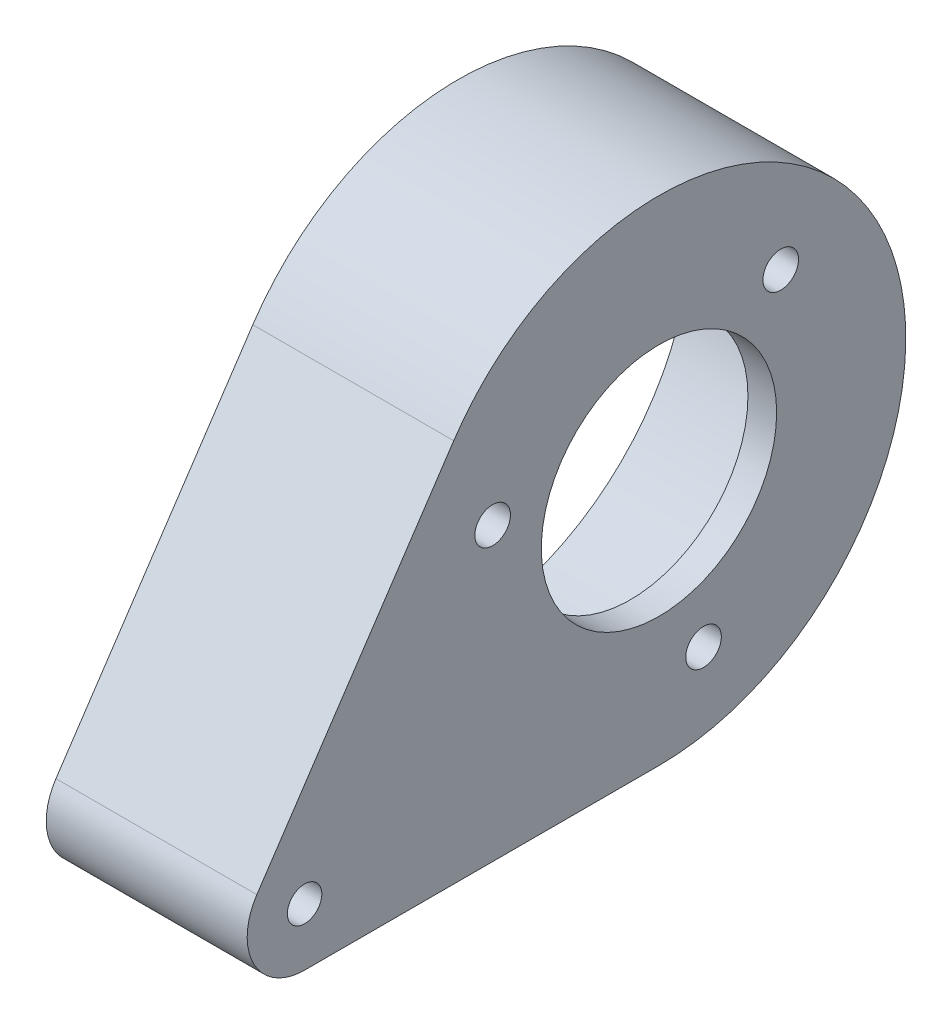
from build123d import *
from build123d.topology import SkipClean

# Parameters (mm, degrees)
EXTRUDE_1_DEPTH     = 2.5
EXTRUDE_START       = 15
SKETCH_2_R          = 20.25
EXTRUDE_2_DEPTH     = 15
SKETCH_3_R          = 1.55
SKETCH_3_R_2        = 10.25
CUT_EXTRUDE_1_DEPTH = 2.5
SKETCH_5_R          = 1.5
CUT_EXTRUDE_2_DEPTH = 46.33118669


with BuildPart() as part:
    # Эскиз1 → Бобышка-Вытянуть1 (new body)
    with BuildSketch(Plane(origin=(0, 0, 0), x_dir=(0, 0, -1), z_dir=(1, 0, 0))):
        with BuildLine():
            Line((-30.866648668, -21.5), (0, -21.5))
            ThreePointArc((0, -21.5), (18.960941325, 10.135714286), (-17.877458963, 11.943469388))
            Line((-17.877458963, 11.943469388), (-35.024197264, -13.72244898))
            ThreePointArc((-35.024197264, -13.72244898), (-35.276169906, -18.857142857), (-30.866648668, -21.5))
        make_face()
    extrude(amount=EXTRUDE_1_DEPTH)

    # Эскиз2 → Бобышка-Вытянуть2 (add)
    with SkipClean():  # the faces are left unmerged after this step: merging them gives an invalid solid
        with BuildSketch(Plane.ZY.offset(EXTRUDE_START)):
            with BuildLine():
                Line((0, -21.5), (30.866648668, -21.5))
                ThreePointArc((30.866648668, -21.5), (35.276169906, -18.857142857), (35.024197264, -13.72244898))
                Line((35.024197264, -13.72244898), (17.877458963, 11.943469388))
                ThreePointArc((17.877458963, 11.943469388), (-18.960941325, 10.135714286), (0, -21.5))
            make_face()
            Circle(SKETCH_2_R, mode=Mode.SUBTRACT)
        extrude(amount=-EXTRUDE_2_DEPTH)

    # Эскиз3 → Вырез-Вытянуть1 (cut)
    with SkipClean():  # the faces are left unmerged after this step: merging them gives an invalid solid
        with BuildSketch(Plane(origin=(2.5, 0, 0), x_dir=(0, 0, -1), z_dir=(1, 0, 0))):
            with Locations((10.606601718, 10.606601718)):
                Circle(SKETCH_3_R)
            with Locations((3.882285677, -14.488887394)):
                Circle(SKETCH_3_R)
            with Locations((-14.488887394, 3.882285677)):
                Circle(SKETCH_3_R)
            Circle(SKETCH_3_R_2)
        extrude(amount=-CUT_EXTRUDE_1_DEPTH, mode=Mode.SUBTRACT)

    # Эскиз5 → Вырез-Вытянуть2 (cut, through all)
    with SkipClean():  # the faces are left unmerged after this step: merging them gives an invalid solid
        with BuildSketch(Plane.ZY.offset(15)):
            with Locations((30.866648668, -16.5)):
                Circle(SKETCH_5_R)
        extrude(amount=-CUT_EXTRUDE_2_DEPTH, mode=Mode.SUBTRACT)


solid = part.part
